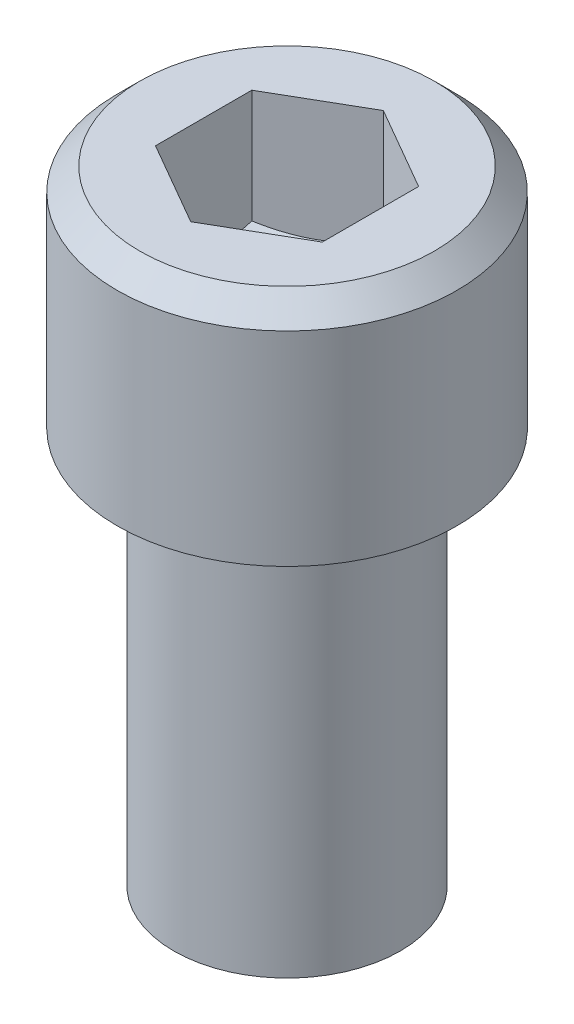
from build123d import *

# Parameters (mm, degrees)
CROQUIS4_R               = 15
SALIENTE_EXTRUIR3_DEPTH  = 20
CHAFL_N2_SIZE            = 2
CROQUIS6_15_R            = 10
SALIENTE_EXTRUIR17_DEPTH = 35


with BuildPart() as part:
    # Croquis4 → Saliente-Extruir3 (new body)
    with BuildSketch(Plane(origin=(0, 0, 0), x_dir=(1, 0, 0), z_dir=(0, 1, 0))):
        Circle(CROQUIS4_R)
        Polygon((0, 8.5), (-7.361215932, 4.25), (-7.361215932, -4.25), (0, -8.5), (7.361215932, -4.25), (7.361215932, 4.25), align=None, mode=Mode.SUBTRACT)
    extrude(amount=SALIENTE_EXTRUIR3_DEPTH)

    # Chaflán2
    chafl_n2_edges = [part.edges().sort_by_distance(p)[0] for p in [
        (-15, 20, 0),
    ]]
    chamfer(chafl_n2_edges, length=CHAFL_N2_SIZE)

    # Croquis5 → Revolución2 (revolve)
    with BuildSketch(Plane.XY):
        Polygon((0, 0), (0, 5.092522712), (8.5, 10), (15, 10), (15, 0), align=None)
    revolve(axis=Axis((0, 0, 0), (0, 1, 0)))

    # Croquis6<15> → Saliente-Extruir17 (add)
    with BuildSketch(Plane.XZ):
        Circle(CROQUIS6_15_R)
    extrude(amount=SALIENTE_EXTRUIR17_DEPTH)


solid = part.part
